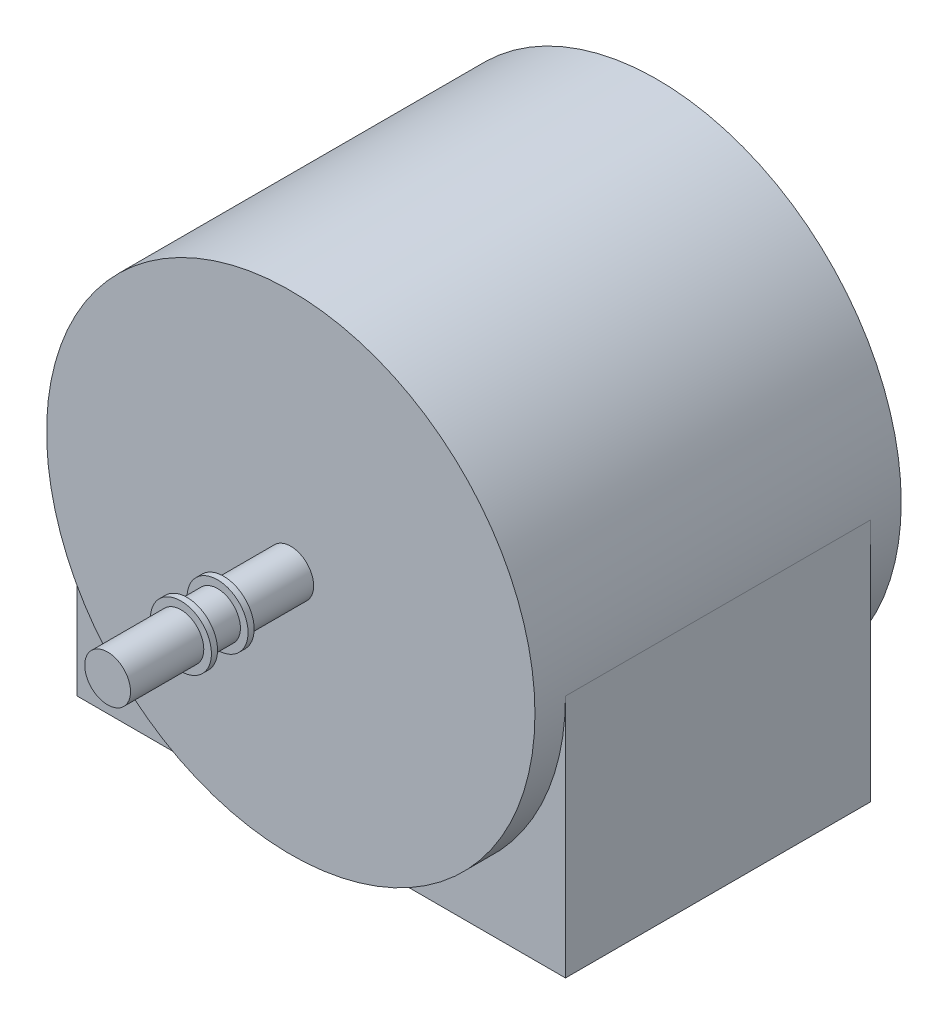
from build123d import *

# Parameters (mm, degrees)
IZIM2_R                     = 80
Y_KSEKLIK_EKSTR_ZYON1_DEPTH = 120
Y_KSEKLIK_EKSTR_ZYON3_START = 10
Y_KSEKLIK_EKSTR_ZYON3_DEPTH = 100
IZIM5_R                     = 5
Y_KSEKLIK_EKSTR_ZYON4_DEPTH = 5
IZIM8_R                     = 7.5
Y_KSEKLIK_EKSTR_ZYON6_DEPTH = 60
Y_KSEKLIK_EKSTR_ZYON7_START = 24
IZIM9_R                     = 10
Y_KSEKLIK_EKSTR_ZYON7_DEPTH = 2
Y_KSEKLIK_EKSTR_ZYON8_START = 12
IZIM10_R                    = 10
Y_KSEKLIK_EKSTR_ZYON8_DEPTH = 2


with BuildPart() as part:
    # Çizim2 → Yükseklik-Ekstrüzyon1 (new body)
    with BuildSketch(Plane.XY):
        Circle(IZIM2_R)
    extrude(amount=Y_KSEKLIK_EKSTR_ZYON1_DEPTH)

    # Çizim3 → Yükseklik-Ekstrüzyon3 (add)
    with BuildSketch(Plane.XY.offset(Y_KSEKLIK_EKSTR_ZYON3_START)):
        with BuildLine():
            ThreePointArc((80, 0), (56.568542608, -56.568542382), (3.2e-07, -80))
            Line((3.2e-07, -80), (80, -80))
            Line((80, -80), (80, 0))
        make_face()
        with BuildLine():
            ThreePointArc((3.2e-07, -80), (-56.568542382, -56.568542608), (-80, 0))
            Line((-80, 0), (-80, -80))
            Line((-80, -80), (3.2e-07, -80))
        make_face()
    extrude(amount=Y_KSEKLIK_EKSTR_ZYON3_DEPTH)

    # Çizim5 → Yükseklik-Ekstrüzyon4 (add)
    with BuildSketch(Plane.XZ.offset(80)):
        with Locations(Location((30, 90, 0), (0, 0, 90))):
            Circle(IZIM5_R)
        with Locations(Location((30, 30, 0), (0, 0, 90))):
            Circle(IZIM5_R)
        with Locations(Location((-30, 90, 0), (0, 0, 90))):
            Circle(IZIM5_R)
        with Locations(Location((-30, 30, 0), (0, 0, 90))):
            Circle(IZIM5_R)
    extrude(amount=Y_KSEKLIK_EKSTR_ZYON4_DEPTH)

    # Çizim8 → Yükseklik-Ekstrüzyon6 (add)
    with BuildSketch(Plane.XY.offset(120)):
        Circle(IZIM8_R)
    extrude(amount=Y_KSEKLIK_EKSTR_ZYON6_DEPTH)

    # Çizim9 → Yükseklik-Ekstrüzyon7 (add)
    with BuildSketch(Plane.XY.offset(120).offset(Y_KSEKLIK_EKSTR_ZYON7_START)):
        Circle(IZIM9_R)
    extrude(amount=-Y_KSEKLIK_EKSTR_ZYON7_DEPTH)

    # Çizim10 → Yükseklik-Ekstrüzyon8 (add)
    with BuildSketch(Plane.XY.offset(144).offset(Y_KSEKLIK_EKSTR_ZYON8_START)):
        Circle(IZIM10_R)
    extrude(amount=-Y_KSEKLIK_EKSTR_ZYON8_DEPTH)


solid = part.part
